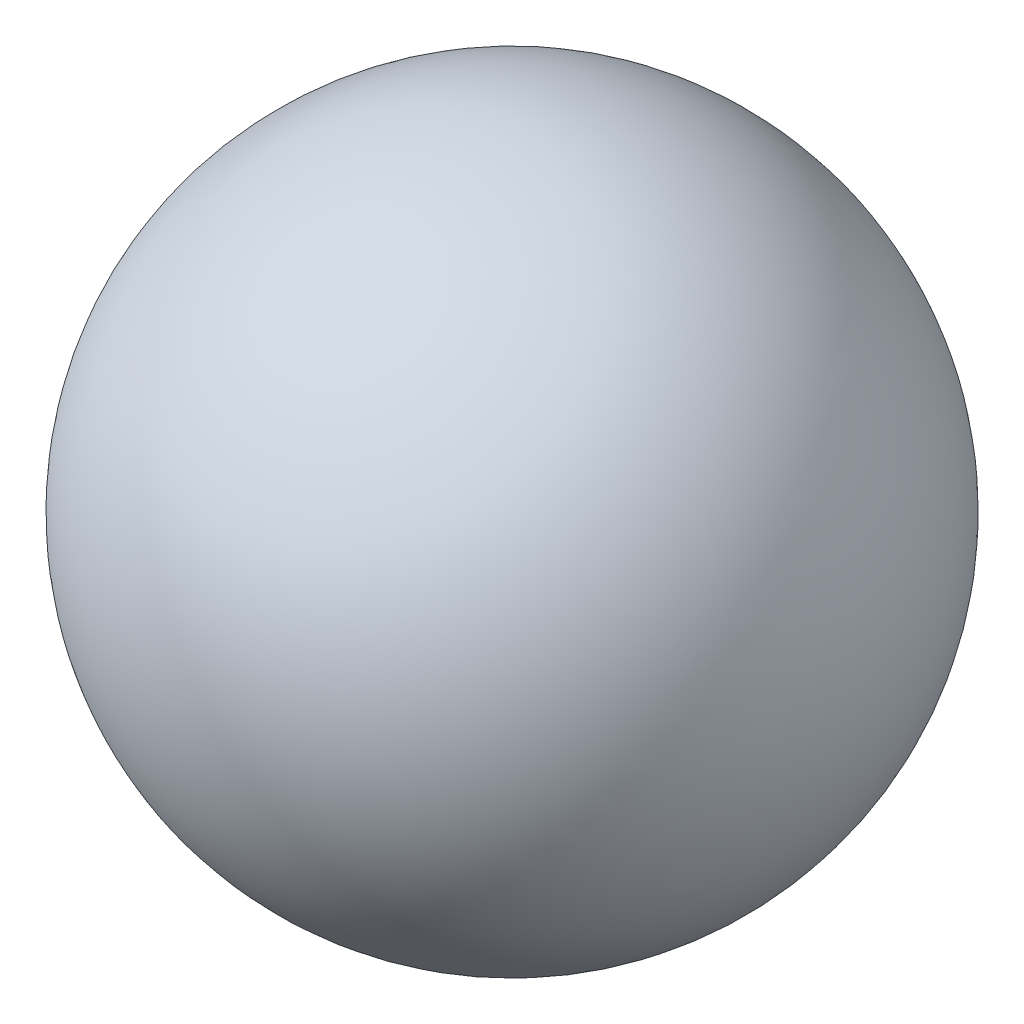
from build123d import *


with BuildPart() as part:
    # Sketch1 → Revolve1 (revolve)
    with BuildSketch(Plane(origin=(0, 0, 0), x_dir=(1, 0, 0), z_dir=(0, 1, 0))):
        with BuildLine():
            Line((0, 0), (0, -28.575))
            ThreePointArc((0, -28.575), (28.575, 0), (0, 28.575))
            Line((0, 28.575), (0, 0))
        make_face()
    revolve(axis=Axis((0, 0, 0), (0, 0, -1)))


solid = part.part
